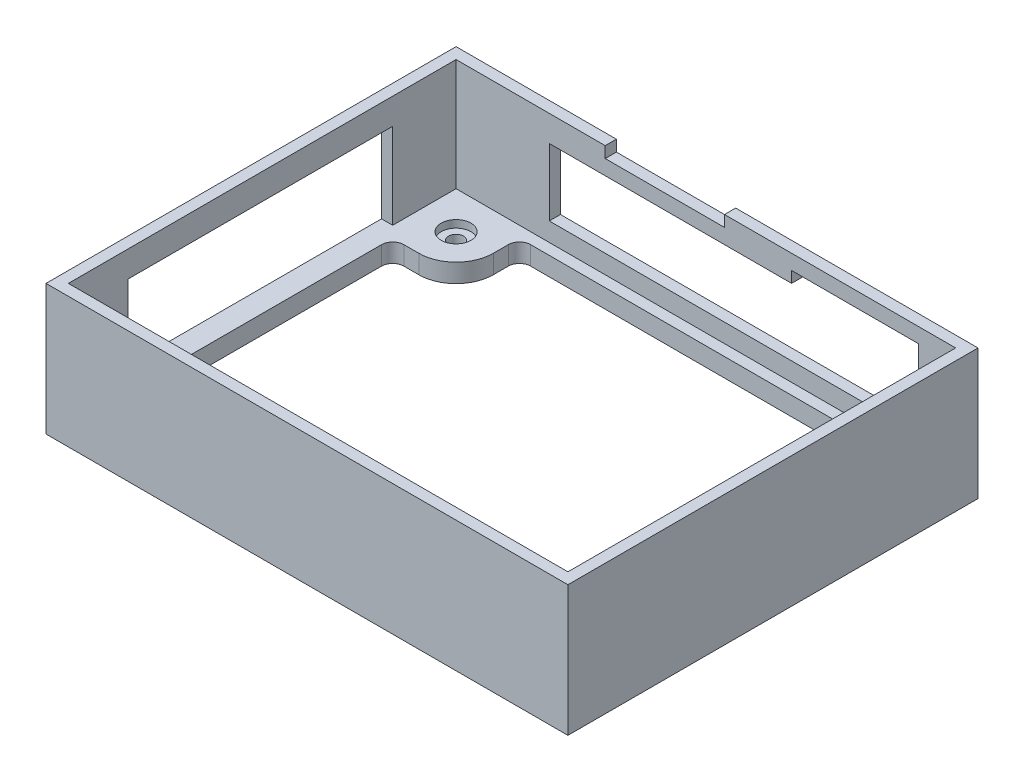
from build123d import *

# Parameters (mm, degrees)
SKETCH1_W           = 140
SKETCH1_H           = 110
BOSS_EXTRUDE1_DEPTH = 5
SKETCH3_W           = 140
SKETCH3_H           = 110
SKETCH3_W_2         = 134
SKETCH3_H_2         = 104
BOSS_EXTRUDE2_DEPTH = 30
CUT_EXTRUDE3_DEPTH  = 5
FILLET1_R           = 3
SKETCH5_R           = 4
CUT_EXTRUDE4_DEPTH  = 2
SKETCH6_R           = 2
CUT_EXTRUDE5_DEPTH  = 5
FILLET2_R           = 10
CUT_EXTRUDE6_DEPTH  = 3
SKETCH9_W           = 32
SKETCH9_H           = 3
CUT_EXTRUDE7_DEPTH  = 3
SKETCH10_W          = 71
SKETCH10_H          = 23
CUT_EXTRUDE8_DEPTH  = 3


with BuildPart() as part:
    # Sketch1 → Boss-Extrude1 (new body)
    with BuildSketch(Plane(origin=(0, 0, 0), x_dir=(1, 0, 0), z_dir=(0, 1, 0))):
        with Locations((70, -55)):
            Rectangle(SKETCH1_W, SKETCH1_H)
    extrude(amount=BOSS_EXTRUDE1_DEPTH)

    # Sketch3 → Boss-Extrude2 (add)
    with BuildSketch(Plane(origin=(0, 5, 0), x_dir=(1, 0, 0), z_dir=(0, 1, 0))):
        with Locations((70, -55)):
            Rectangle(SKETCH3_W, SKETCH3_H)
        with Locations((70, -55)):
            Rectangle(SKETCH3_W_2, SKETCH3_H_2, mode=Mode.SUBTRACT)
    extrude(amount=BOSS_EXTRUDE2_DEPTH)

    # Sketch4 → Cut-Extrude3 (cut)
    with BuildSketch(Plane(origin=(0, 5, 0), x_dir=(1, 0, 0), z_dir=(0, 1, 0))):
        Polygon((23, -6), (23, -23), (6, -23), (6, -87), (23, -87), (23, -104), (117, -104), (117, -87), (134, -87), (134, -23), (117, -23), (117, -6), align=None)
    extrude(amount=-CUT_EXTRUDE3_DEPTH, mode=Mode.SUBTRACT)

    # Fillet1
    fillet1_edges = [part.edges().sort_by_distance(p)[0] for p in [
        (23, 2.5, 6),
        (117, 2.5, 6),
        (134, 2.5, 23),
        (134, 2.5, 87),
        (117, 2.5, 104),
        (23, 2.5, 104),
        (6, 2.5, 87),
        (6, 2.5, 23),
    ]]
    fillet(fillet1_edges, radius=FILLET1_R)

    # Sketch5 → Cut-Extrude4 (cut)
    with BuildSketch(Plane(origin=(0, 5, 0), x_dir=(1, 0, 0), z_dir=(0, 1, 0))):
        with Locations(Location((13, -13, 0), (0, 0, 270))):
            Circle(SKETCH5_R)
        with Locations(Location((13, -97, 0), (0, 0, 270))):
            Circle(SKETCH5_R)
    cut_extrude4 = extrude(amount=-CUT_EXTRUDE4_DEPTH, mode=Mode.SUBTRACT)

    # Sketch6 → Cut-Extrude5 (cut)
    with BuildSketch(Plane(origin=(0, 5, 0), x_dir=(1, 0, 0), z_dir=(0, 1, 0))):
        with Locations(Location((13, -13, 0), (0, 0, 270))):
            Circle(SKETCH6_R)
        with Locations(Location((13, -97, 0), (0, 0, 270))):
            Circle(SKETCH6_R)
    cut_extrude5 = extrude(amount=-CUT_EXTRUDE5_DEPTH, mode=Mode.SUBTRACT)

    # Mirror1: Cut-Extrude4, Cut-Extrude5 across plane
    add(cut_extrude4.mirror(Plane(origin=(70, 0, 0), x_dir=(0, 0, 1), z_dir=(1, 0, 0))), mode=Mode.SUBTRACT)
    add(cut_extrude5.mirror(Plane(origin=(70, 0, 0), x_dir=(0, 0, 1), z_dir=(1, 0, 0))), mode=Mode.SUBTRACT)

    # Fillet2
    fillet2_edges = [part.edges().sort_by_distance(p)[0] for p in [
        (117, 2.5, 23),
        (117, 2.5, 87),
        (23, 2.5, 87),
        (23, 2.5, 23),
    ]]
    fillet(fillet2_edges, radius=FILLET2_R)

    # Sketch8 → Cut-Extrude6 (cut)
    with BuildSketch(Plane(origin=(0, 0, 0), x_dir=(-1, 0, 0), z_dir=(0, 0, -1))):
        Polygon((-127, 31), (-127, 10), (-28, 10), (-28, 28), (-93, 28), (-93, 31), align=None)
    extrude(amount=-CUT_EXTRUDE6_DEPTH, mode=Mode.SUBTRACT)

    # Sketch9 → Cut-Extrude7 (cut)
    with BuildSketch(Plane(origin=(0, 0, 0), x_dir=(-1, 0, 0), z_dir=(0, 0, -1))):
        with Locations((-59, 33.5)):
            Rectangle(SKETCH9_W, SKETCH9_H)
    extrude(amount=-CUT_EXTRUDE7_DEPTH, mode=Mode.SUBTRACT)

    # Sketch10 → Cut-Extrude8 (cut)
    with BuildSketch(Plane.ZY):
        with Locations((55.5, 16.5)):
            Rectangle(SKETCH10_W, SKETCH10_H)
    extrude(amount=-CUT_EXTRUDE8_DEPTH, mode=Mode.SUBTRACT)


solid = part.part
